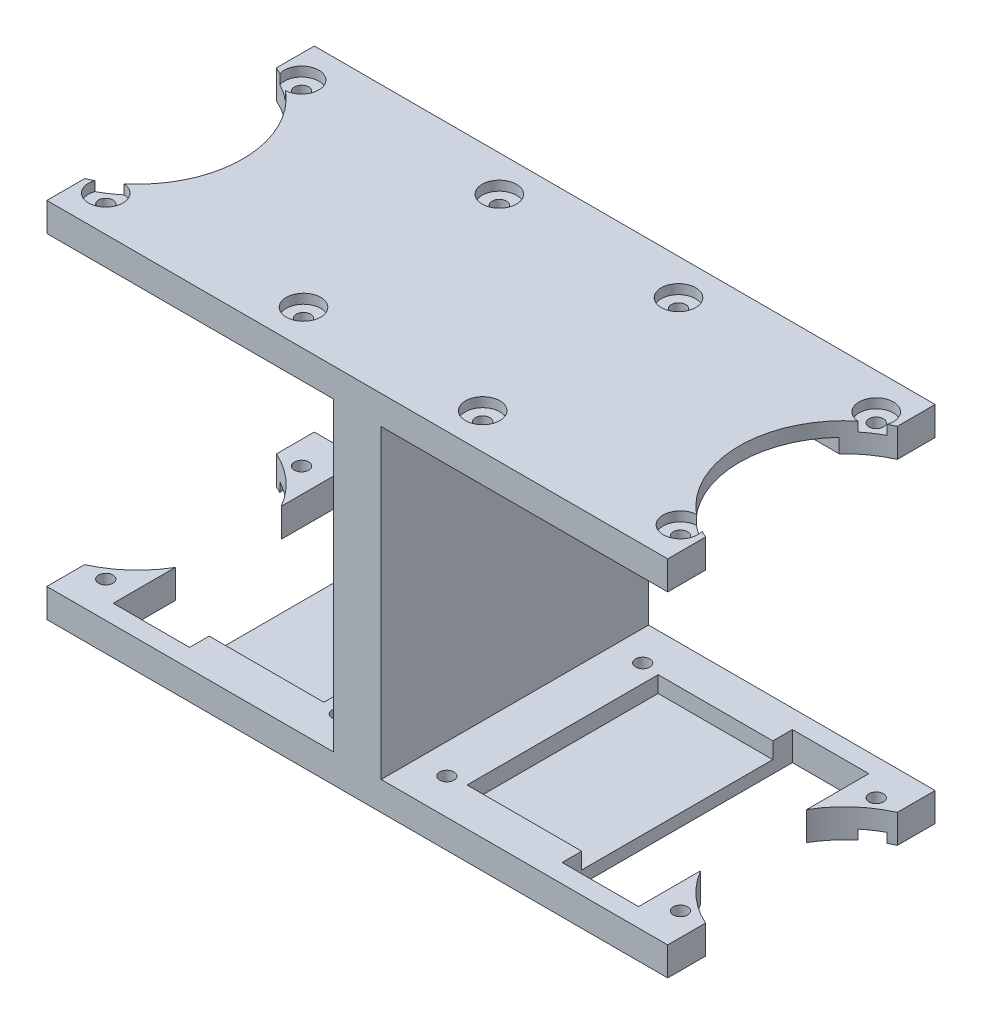
from build123d import *

# Parameters (mm, degrees)
SKETCH_1_W           = 65
SKETCH_1_H           = 38
EXTRUDE_1_DEPTH      = 28
SKETCH_2_W           = 30
SKETCH_2_H           = 32
CUT_EXTRUDE_1_DEPTH  = 81.330567034
CUT_EXTRUDE_3_REACH  = 82.331
SKETCH_3_R           = 0.75
SKETCH_4_W           = 15
SKETCH_4_H           = 1.5
CUT_EXTRUDE_4_DEPTH  = 30
SKETCH_5_R           = 11
CUT_EXTRUDE_5_DEPTH  = 81.330567034
CUT_EXTRUDE_6_REACH  = 82.331
SKETCH_6_R           = 0.75
CUT_EXTRUDE_7_REACH  = 82.331
SKETCH_7_W           = 8
SKETCH_7_H           = 24.102688632
SKETCH_8_R           = 1.8
CUT_EXTRUDE_8_DEPTH  = 1
CUT_EXTRUDE_START    = -1
SKETCH_9_R           = 1.8
CUT_EXTRUDE_9_DEPTH  = 1
SKETCH_10_W          = 20
SKETCH_10_H          = 1.7
CUT_EXTRUDE_10_DEPTH = 12


with BuildPart() as part:
    # 草图1 → 凸台-拉伸1 (new body)
    with BuildSketch(Plane.XY):
        with Locations((32.5, 19)):
            Rectangle(SKETCH_1_W, SKETCH_1_H)
    extrude(amount=EXTRUDE_1_DEPTH)

    # 草图2 → 切除-拉伸1 (cut, through all)
    with BuildSketch(Plane.XY.offset(28)):
        with Locations((15, 19)):
            Rectangle(SKETCH_2_W, SKETCH_2_H)
    cut_extrude_1 = extrude(amount=-CUT_EXTRUDE_1_DEPTH, mode=Mode.SUBTRACT)

    # 草图3 → 切除-拉伸3 (cut, up to next)
    with BuildSketch(Plane(origin=(0, 38, 0), x_dir=(1, 0, 0), z_dir=(0, 1, 0)), mode=Mode.PRIVATE) as cut_extrude_3_sk1:
        with Locations(Location((2.42, -3.75, 0), (0, 0, 270))):
            Circle(SKETCH_3_R)
    cut_extrude_3_tool1 = extrude(cut_extrude_3_sk1.sketch, amount=-CUT_EXTRUDE_3_REACH, mode=Mode.PRIVATE) & part.part
    # 草图3 → 切除-拉伸3 (cut, up to next)
    with BuildSketch(Plane(origin=(0, 38, 0), x_dir=(1, 0, 0), z_dir=(0, 1, 0)), mode=Mode.PRIVATE) as cut_extrude_3_sk2:
        with Locations(Location((23.12, -3.75, 0), (0, 0, 270))):
            Circle(SKETCH_3_R)
    cut_extrude_3_tool2 = extrude(cut_extrude_3_sk2.sketch, amount=-CUT_EXTRUDE_3_REACH, mode=Mode.PRIVATE) & part.part
    # 草图3 → 切除-拉伸3 (cut, up to next)
    with BuildSketch(Plane(origin=(0, 38, 0), x_dir=(1, 0, 0), z_dir=(0, 1, 0)), mode=Mode.PRIVATE) as cut_extrude_3_sk3:
        with Locations(Location((23.12, -24.25, 0), (0, 0, 270))):
            Circle(SKETCH_3_R)
    cut_extrude_3_tool3 = extrude(cut_extrude_3_sk3.sketch, amount=-CUT_EXTRUDE_3_REACH, mode=Mode.PRIVATE) & part.part
    # 草图3 → 切除-拉伸3 (cut, up to next)
    with BuildSketch(Plane(origin=(0, 38, 0), x_dir=(1, 0, 0), z_dir=(0, 1, 0)), mode=Mode.PRIVATE) as cut_extrude_3_sk4:
        with Locations(Location((2.42, -24.25, 0), (0, 0, 270))):
            Circle(SKETCH_3_R)
    cut_extrude_3_tool4 = extrude(cut_extrude_3_sk4.sketch, amount=-CUT_EXTRUDE_3_REACH, mode=Mode.PRIVATE) & part.part
    cut_extrude_3_1 = cut_extrude_3_tool1.solids().sort_by_distance((2.42, 38, 3.75))[0]
    add(cut_extrude_3_1, mode=Mode.SUBTRACT)
    cut_extrude_3_2 = cut_extrude_3_tool2.solids().sort_by_distance((23.12, 38, 3.75))[0]
    add(cut_extrude_3_2, mode=Mode.SUBTRACT)
    cut_extrude_3_3 = cut_extrude_3_tool3.solids().sort_by_distance((23.12, 38, 24.25))[0]
    add(cut_extrude_3_3, mode=Mode.SUBTRACT)
    cut_extrude_3_4 = cut_extrude_3_tool4.solids().sort_by_distance((2.42, 38, 24.25))[0]
    add(cut_extrude_3_4, mode=Mode.SUBTRACT)
    cut_extrude_3 = cut_extrude_3_1 + cut_extrude_3_2 + cut_extrude_3_3 + cut_extrude_3_4  # 切除-拉伸3 as one shape, for the pattern or mirror that repeats it

    # 草图4 → 切除-拉伸4 (cut)
    with BuildSketch(Plane.ZY):
        with Locations((14, 35.75)):
            Rectangle(SKETCH_4_W, SKETCH_4_H)
    cut_extrude_4 = extrude(amount=-CUT_EXTRUDE_4_DEPTH, mode=Mode.SUBTRACT)

    # 草图5 → 切除-拉伸5 (cut, through all)
    with BuildSketch(Plane(origin=(0, 38, 0), x_dir=(1, 0, 0), z_dir=(0, 1, 0))):
        with Locations((-4.5, -14)):
            Circle(SKETCH_5_R)
    cut_extrude_5 = extrude(amount=-CUT_EXTRUDE_5_DEPTH, mode=Mode.SUBTRACT)

    # 草图6 → 切除-拉伸6 (cut, up to next)
    with BuildSketch(Plane.XZ, mode=Mode.PRIVATE) as cut_extrude_6_sk1:
        with Locations(Location((2.42, 3.75, 0), (0, 0, 90))):
            Circle(SKETCH_6_R)
    cut_extrude_6_tool1 = extrude(cut_extrude_6_sk1.sketch, amount=-CUT_EXTRUDE_6_REACH, mode=Mode.PRIVATE) & part.part
    # 草图6 → 切除-拉伸6 (cut, up to next)
    with BuildSketch(Plane.XZ, mode=Mode.PRIVATE) as cut_extrude_6_sk2:
        with Locations(Location((2.42, 24.25, 0), (0, 0, 90))):
            Circle(SKETCH_6_R)
    cut_extrude_6_tool2 = extrude(cut_extrude_6_sk2.sketch, amount=-CUT_EXTRUDE_6_REACH, mode=Mode.PRIVATE) & part.part
    # 草图6 → 切除-拉伸6 (cut, up to next)
    with BuildSketch(Plane.XZ, mode=Mode.PRIVATE) as cut_extrude_6_sk3:
        with Locations(Location((26.87, 24.25, 0), (0, 0, 270))):
            Circle(SKETCH_6_R)
    cut_extrude_6_tool3 = extrude(cut_extrude_6_sk3.sketch, amount=-CUT_EXTRUDE_6_REACH, mode=Mode.PRIVATE) & part.part
    # 草图6 → 切除-拉伸6 (cut, up to next)
    with BuildSketch(Plane.XZ, mode=Mode.PRIVATE) as cut_extrude_6_sk4:
        with Locations(Location((26.87, 3.75, 0), (0, 0, 270))):
            Circle(SKETCH_6_R)
    cut_extrude_6_tool4 = extrude(cut_extrude_6_sk4.sketch, amount=-CUT_EXTRUDE_6_REACH, mode=Mode.PRIVATE) & part.part
    cut_extrude_6_1 = cut_extrude_6_tool1.solids().sort_by_distance((2.42, 0, 3.75))[0]
    add(cut_extrude_6_1, mode=Mode.SUBTRACT)
    cut_extrude_6_2 = cut_extrude_6_tool2.solids().sort_by_distance((2.42, 0, 24.25))[0]
    add(cut_extrude_6_2, mode=Mode.SUBTRACT)
    cut_extrude_6_3 = cut_extrude_6_tool3.solids().sort_by_distance((26.87, 0, 24.25))[0]
    add(cut_extrude_6_3, mode=Mode.SUBTRACT)
    cut_extrude_6_4 = cut_extrude_6_tool4.solids().sort_by_distance((26.87, 0, 3.75))[0]
    add(cut_extrude_6_4, mode=Mode.SUBTRACT)
    cut_extrude_6 = cut_extrude_6_1 + cut_extrude_6_2 + cut_extrude_6_3 + cut_extrude_6_4  # 切除-拉伸6 as one shape, for the pattern or mirror that repeats it

    # 草图7 → 切除-拉伸7 (cut, up to next)
    with BuildSketch(Plane.XZ, mode=Mode.PRIVATE) as cut_extrude_7_sk1:
        with Locations((9, 14)):
            Rectangle(SKETCH_7_W, SKETCH_7_H)
    cut_extrude_7_tool1 = extrude(cut_extrude_7_sk1.sketch, amount=-CUT_EXTRUDE_7_REACH, mode=Mode.PRIVATE) & part.part
    cut_extrude_7 = cut_extrude_7_tool1.solids().sort_by_distance((9, 0, 14))[0]
    add(cut_extrude_7, mode=Mode.SUBTRACT)

    # 草图8 → 切除-拉伸8 (cut)
    with BuildSketch(Plane(origin=(0, 38, 0), x_dir=(1, 0, 0), z_dir=(0, 1, 0))):
        with Locations(Location((23.12, -3.75, 0), (0, 0, 270))):
            Circle(SKETCH_8_R)
        with Locations((2.42, -3.75)):
            Circle(SKETCH_8_R)
        with Locations((2.42, -24.25)):
            Circle(SKETCH_8_R)
        with Locations(Location((23.12, -24.25, 0), (0, 0, 270))):
            Circle(SKETCH_8_R)
    cut_extrude_8 = extrude(amount=-CUT_EXTRUDE_8_DEPTH, mode=Mode.SUBTRACT)

    # 草图9 → 切除-拉伸9 (cut)
    with BuildSketch(Plane.XZ.offset(CUT_EXTRUDE_START)):
        with Locations((2.42, 24.25)):
            Circle(SKETCH_9_R)
        with Locations(Location((26.87, 24.25, 0), (0, 0, 270))):
            Circle(SKETCH_9_R)
        with Locations(Location((26.87, 3.75, 0), (0, 0, 270))):
            Circle(SKETCH_9_R)
        with Locations((2.42, 3.75)):
            Circle(SKETCH_9_R)
    cut_extrude_9 = extrude(amount=CUT_EXTRUDE_9_DEPTH, mode=Mode.SUBTRACT)

    # 草图10 → 切除-拉伸10 (cut)
    with BuildSketch(Plane.ZY.offset(-13)):
        with Locations((14, 2.15)):
            Rectangle(SKETCH_10_W, SKETCH_10_H)
    cut_extrude_10 = extrude(amount=-CUT_EXTRUDE_10_DEPTH, mode=Mode.SUBTRACT)

    # 镜向1: 切除-拉伸1, 切除-拉伸3, 切除-拉伸4, 切除-拉伸5, 切除-拉伸6, 切除-拉伸7, 切除-拉伸8, 切除-拉伸9, 切除-拉伸10 across plane
    add(cut_extrude_1.mirror(Plane.ZY.offset(-32.5)), mode=Mode.SUBTRACT)
    add(cut_extrude_3.mirror(Plane.ZY.offset(-32.5)), mode=Mode.SUBTRACT)
    add(cut_extrude_4.mirror(Plane.ZY.offset(-32.5)), mode=Mode.SUBTRACT)
    add(cut_extrude_5.mirror(Plane.ZY.offset(-32.5)), mode=Mode.SUBTRACT)
    add(cut_extrude_6.mirror(Plane.ZY.offset(-32.5)), mode=Mode.SUBTRACT)
    add(cut_extrude_7.mirror(Plane.ZY.offset(-32.5)), mode=Mode.SUBTRACT)
    add(cut_extrude_8.mirror(Plane.ZY.offset(-32.5)), mode=Mode.SUBTRACT)
    add(cut_extrude_9.mirror(Plane.ZY.offset(-32.5)), mode=Mode.SUBTRACT)
    add(cut_extrude_10.mirror(Plane.ZY.offset(-32.5)), mode=Mode.SUBTRACT)


solid = part.part
